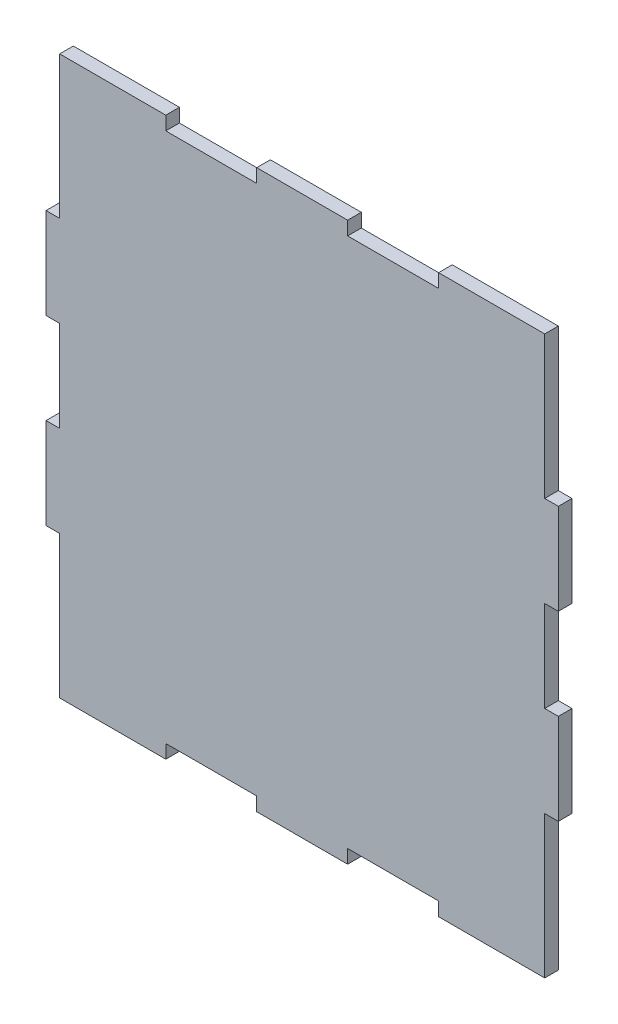
from build123d import *

# Parameters (mm, degrees)
BOSS_EXTRUDE1_DEPTH = 9


with BuildPart() as part:
    # Sketch1 → Boss-Extrude1 (new body)
    with BuildSketch(Plane.XY):
        Polygon((61, 5.5), (121, 5.5), (121, -3.5), (181, -3.5), (181, 5.5), (241, 5.5), (241, -3.5), (311, -3.5), (311, 9.67), (311, 90.5), (320, 90.5), (320, 150.5), (311, 150.5), (311, 210.5), (320, 210.5), (320, 270.5), (311, 270.5), (311, 364.5), (241, 364.5), (241, 355.5), (181, 355.5), (181, 364.5), (121, 364.5), (121, 355.5), (61, 355.5), (61, 364.5), (-9, 364.5), (-9, 270.5), (-18, 270.5), (-18, 210.5), (-9, 210.5), (-9, 150.5), (-18, 150.5), (-18, 90.5), (-9, 90.5), (-9, 5.5), (-9, -3.5), (61, -3.5), align=None)
    extrude(amount=BOSS_EXTRUDE1_DEPTH)


solid = part.part
